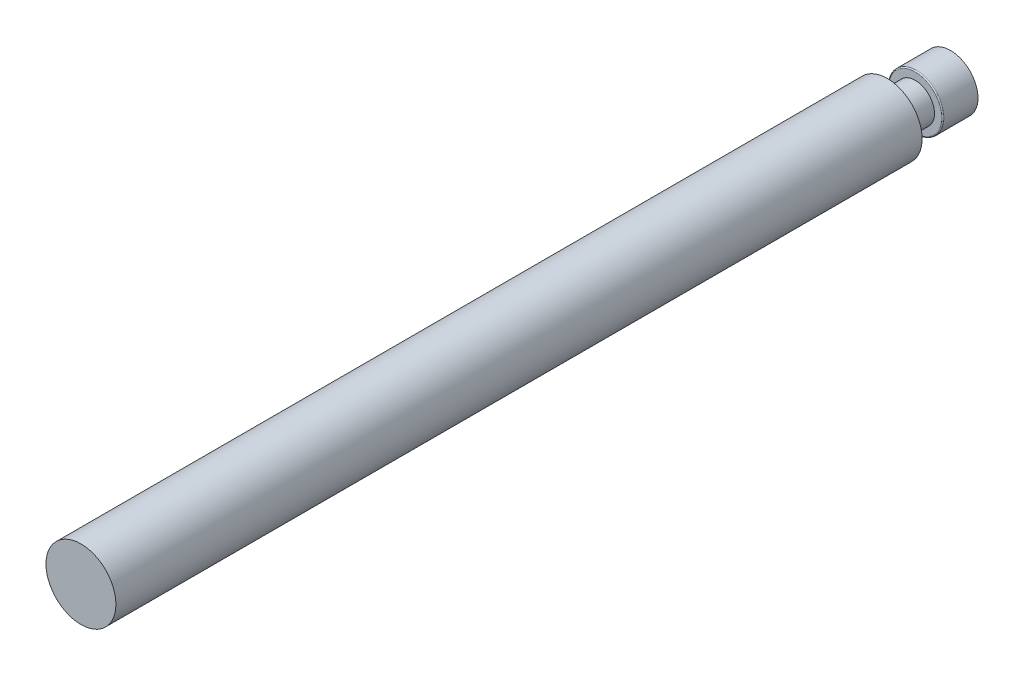
from build123d import *

# Parameters (mm, degrees)
ESBO_O1_R                = 6.35
RESSALTO_EXTRUS_O1_DEPTH = 160
ESBO_O2_OUTSIDE_W        = 46.9
ESBO_O2_OUTSIDE_H        = 46.9
ESBO_O2_OUTSIDE_R        = 5
CORTE_EXTRUS_O1_DEPTH    = 12
ESBO_O4_OUTSIDE_W        = 46.9
ESBO_O4_OUTSIDE_H        = 46.9
ESBO_O4_OUTSIDE_R        = 3.5
CORTE_EXTRUS_O2_DEPTH    = 3.6
FILETE1_R                = 0.2
CHANFRO2_SIZE            = 2
CHANFRO2_SIZE2           = 3.464101615
CHANFRO3_SIZE            = 1.5
CHANFRO3_SIZE2           = 2.598076211


with BuildPart() as part:
    # Esboço1 → Ressalto-extrusão1 (new body)
    with BuildSketch(Plane.XY):
        Circle(ESBO_O1_R)
    extrude(amount=RESSALTO_EXTRUS_O1_DEPTH)

    # Esboço2 outside → Corte-extrusão1 (cut)
    with BuildSketch(Plane(origin=(0, 0, 0), x_dir=(-1, 0, 0), z_dir=(0, 0, -1))):
        Rectangle(ESBO_O2_OUTSIDE_W, ESBO_O2_OUTSIDE_H)
        Circle(ESBO_O2_OUTSIDE_R, mode=Mode.SUBTRACT)
    extrude(amount=-CORTE_EXTRUS_O1_DEPTH, mode=Mode.SUBTRACT)

    # Esboço4 outside → Corte-extrusão2 (cut)
    with BuildSketch(Plane(origin=(0, 0, 12), x_dir=(-1, 0, 0), z_dir=(0, 0, -1))):
        Rectangle(ESBO_O4_OUTSIDE_W, ESBO_O4_OUTSIDE_H)
        Circle(ESBO_O4_OUTSIDE_R, mode=Mode.SUBTRACT)
    extrude(amount=CORTE_EXTRUS_O2_DEPTH, mode=Mode.SUBTRACT)

    # Filete1
    filete1_edges = [part.edges().sort_by_distance(p)[0] for p in [
        (5, 0, 8.4),
    ]]
    fillet(filete1_edges, radius=FILETE1_R)

    # Chanfro2
    chanfro2_edges = [part.edges().sort_by_distance(p)[0] for p in [
        (5, 0, 0),
    ]]
    chanfro2_side = [part.faces().sort_by_distance(p)[0] for p in [
        (5, 0, 4.1),
    ]]
    chamfer(chanfro2_edges, length=CHANFRO2_SIZE, length2=CHANFRO2_SIZE2, reference=chanfro2_side[0])

    # Chanfro3
    chanfro3_edges = [part.edges().sort_by_distance(p)[0] for p in [
        (-6.35, 0, 12),
    ]]
    chanfro3_side = [part.faces().sort_by_distance(p)[0] for p in [
        (-6.35, 0, 86),
    ]]
    chamfer(chanfro3_edges, length=CHANFRO3_SIZE, length2=CHANFRO3_SIZE2, reference=chanfro3_side[0])


solid = part.part
